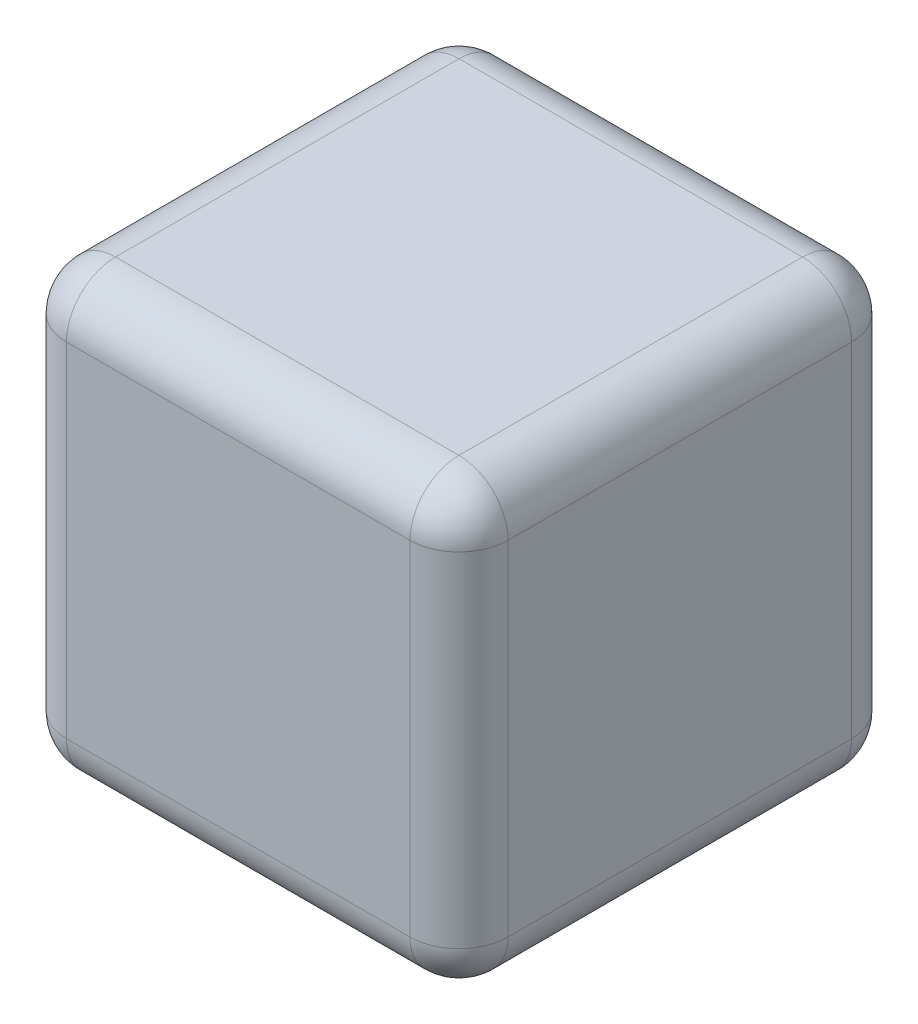
from build123d import *

# Parameters (mm, degrees)
SKETCH1_W           = 9
SKETCH1_H           = 9
BOSS_EXTRUDE1_DEPTH = 4.5
FILLET1_R           = 1


with BuildPart() as part:
    # Sketch1 → Boss-Extrude1 (new, symmetric)
    with BuildSketch(Plane(origin=(0, 0, 0), x_dir=(0, 0, -1), z_dir=(1, 0, 0))):
        Rectangle(SKETCH1_W, SKETCH1_H)
    extrude(amount=BOSS_EXTRUDE1_DEPTH, both=True)

    # Fillet1
    fillet1_edges = [part.edges().sort_by_distance(p)[0] for p in [
        (4.5, 0, 4.5),
        (4.5, -4.5, 0),
        (4.5, 0, -4.5),
        (-4.5, -4.5, 0),
        (-4.5, 0, 4.5),
        (-4.5, 4.5, 0),
        (-4.5, 0, -4.5),
        (0, -4.5, -4.5),
        (0, -4.5, 4.5),
        (0, 4.5, 4.5),
        (0, 4.5, -4.5),
        (4.5, 4.5, 0),
    ]]
    fillet(fillet1_edges, radius=FILLET1_R)


solid = part.part
